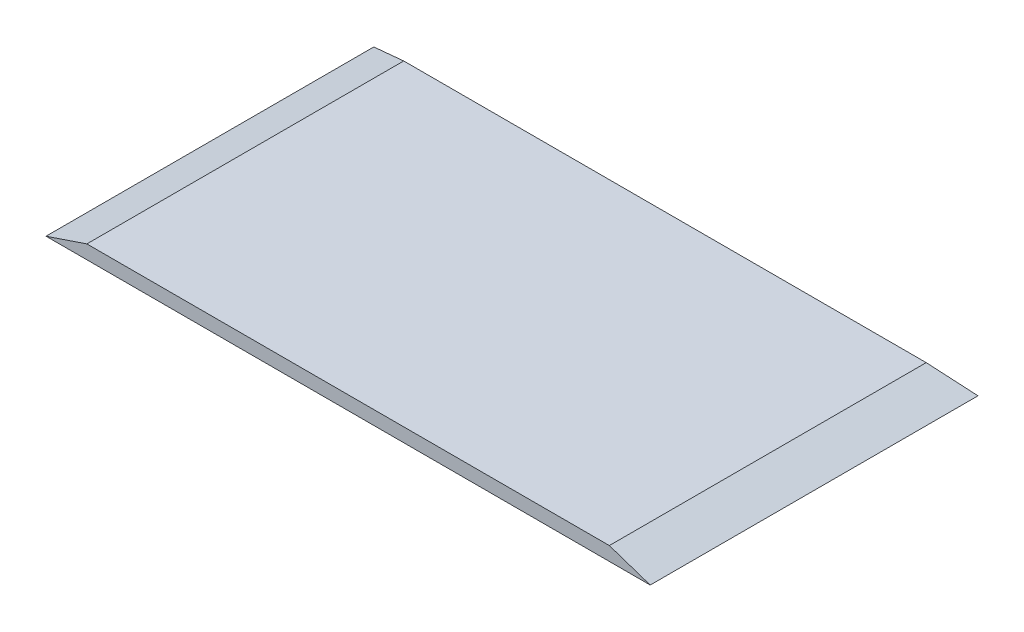
from build123d import *

# Parameters (mm, degrees)
ESBO_O1_W                = 55.3
ESBO_O1_H                = 30
RESSALTO_EXTRUS_O1_DEPTH = 1.26
CORTE_EXTRUS_O1_DEPTH    = 63.925969202
CORTE_EXTRUS_O2_DEPTH    = 63.925969202


with BuildPart() as part:
    # Esboço1 → Ressalto-extrusão1 (new body)
    with BuildSketch(Plane(origin=(0, 0, 0), x_dir=(1, 0, 0), z_dir=(0, 1, 0))):
        with Locations((27.65, 15)):
            Rectangle(ESBO_O1_W, ESBO_O1_H)
    extrude(amount=RESSALTO_EXTRUS_O1_DEPTH)

    # Esboço2 → Corte-extrusão1 (cut, through all)
    with BuildSketch(Plane.ZY):
        Polygon((-30, 0), (-29, 1.26), (-30, 1.26), align=None)
    extrude(amount=-CORTE_EXTRUS_O1_DEPTH, mode=Mode.SUBTRACT)

    # Esboço3 → Corte-extrusão2 (cut, through all)
    with BuildSketch(Plane.XY):
        Polygon((0, 1.26), (0, 0), (3.74, 1.26), align=None)
        Polygon((55.3, 1.26), (51.56, 1.26), (55.3, 0), align=None)
    extrude(amount=-CORTE_EXTRUS_O2_DEPTH, mode=Mode.SUBTRACT)


solid = part.part
